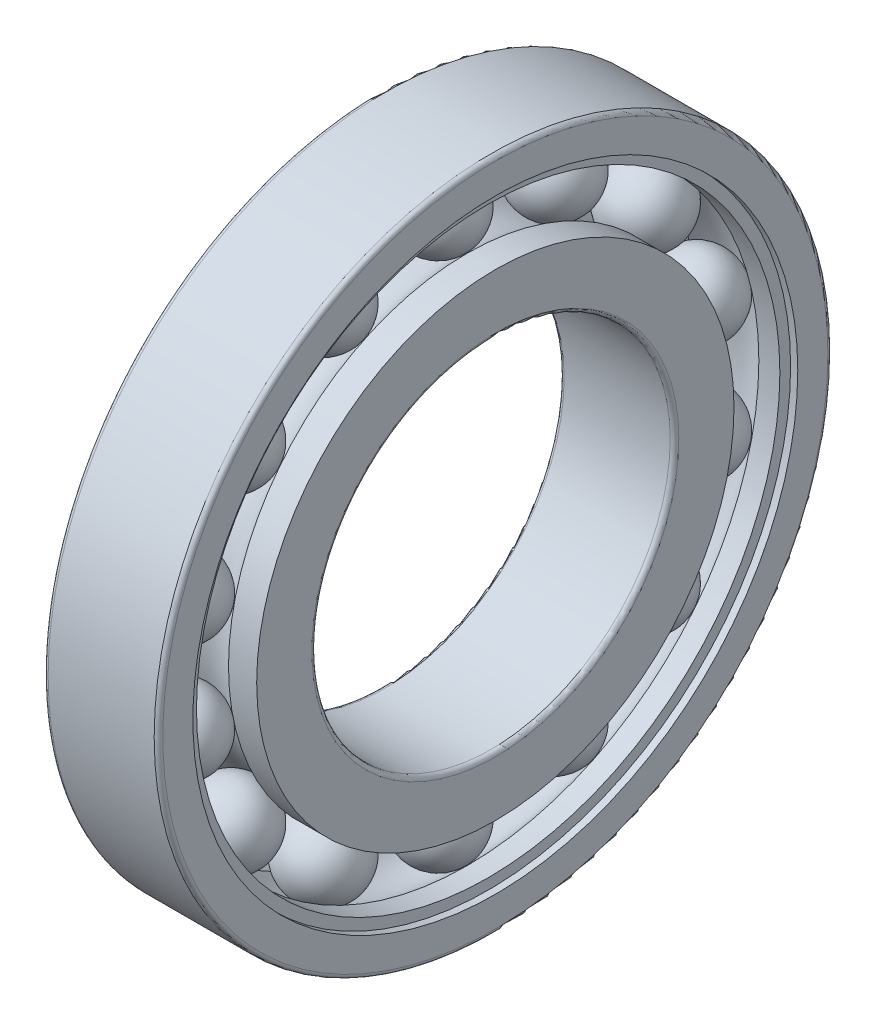
from build123d import *

# Parameters (mm, degrees)
SKETCH2_R          = 21.1
SKETCH2_R_2        = 20.35
CUT_EXTRUDE1_DEPTH = 0.5
FILLET1_R          = 0.3
FILLET2_R          = 0.3
CIRPATTERN4_COUNT  = 14


with BuildPart() as part:
    # Sketch1 → Revolve1 (revolve)
    with BuildSketch(Plane.XY, mode=Mode.PRIVATE) as revolve1_sk:
        with BuildLine():
            Line((4, 20.35), (4, 23.5))
            Line((4, 23.5), (-4, 23.5))
            Line((-4, 23.5), (-4, 20.35))
            Line((-4, 20.35), (-2.034698995, 20.35))
            ThreePointArc((-2.034698995, 20.35), (0, 21.25), (2.034698995, 20.35))
            Line((2.034698995, 20.35), (4, 20.35))
        make_face()
        with BuildLine():
            ThreePointArc((2.034698995, 16.65), (0, 15.75), (-2.034698995, 16.65))
            Line((-2.034698995, 16.65), (-4, 16.65))
            Line((-4, 16.65), (-4, 12.5))
            Line((-4, 12.5), (4, 12.5))
            Line((4, 12.5), (4, 16.65))
            Line((4, 16.65), (2.034698995, 16.65))
        make_face()
    revolve(revolve1_sk.sketch.rotate(Axis((0, 0, 0), (1, 0, 0)), 90), axis=Axis((0, 0, 0), (1, 0, 0)))

    # Sketch2 → Cut-Extrude1 (cut)
    with BuildSketch(Plane(origin=(4, 0, 0), x_dir=(0, 0, -1), z_dir=(1, 0, 0))):
        Circle(SKETCH2_R)
        with Locations(Location((0, 0, 0), (0, 0, 180))):
            Circle(SKETCH2_R_2, mode=Mode.SUBTRACT)
    cut_extrude1 = extrude(amount=-CUT_EXTRUDE1_DEPTH, mode=Mode.SUBTRACT)

    # Mirror1: Cut-Extrude1 across plane
    add(cut_extrude1.mirror(Plane(origin=(0, 0, 0), x_dir=(0, 0, 1), z_dir=(1, 0, 0))), mode=Mode.SUBTRACT)

    # Fillet1
    fillet1_edges = [part.edges().sort_by_distance(p)[0] for p in [
        (-4, 0, -23.5),
        (4, 0, -23.5),
    ]]
    fillet(fillet1_edges, radius=FILLET1_R)

    # Fillet2
    fillet2_edges = [part.edges().sort_by_distance(p)[0] for p in [
        (4, 0, -12.5),
        (-4, 0, -12.5),
    ]]
    fillet(fillet2_edges, radius=FILLET2_R)


with BuildPart() as body_2:
    # Sketch3 → Revolve2 (revolve)
    with BuildSketch(Plane.XY):
        with BuildLine():
            Line((-2.725, 18.5), (2.725, 18.5))
            ThreePointArc((2.725, 18.5), (0, 21.225), (-2.725, 18.5))
        make_face()
    revolve(axis=Axis((-2.725, 18.5, 0), (1, 0, 0)))


with BuildPart() as cirpattern4_1:
    # CirPattern4: pattern copy
    add(body_2.part.rotate(Axis((0, 0, 0), (1, 0, 0)), 1 * 360 / CIRPATTERN4_COUNT))


with BuildPart() as cirpattern4_2:
    # CirPattern4: pattern copy
    add(body_2.part.rotate(Axis((0, 0, 0), (1, 0, 0)), 2 * 360 / CIRPATTERN4_COUNT))


with BuildPart() as cirpattern4_3:
    # CirPattern4: pattern copy
    add(body_2.part.rotate(Axis((0, 0, 0), (1, 0, 0)), 3 * 360 / CIRPATTERN4_COUNT))


with BuildPart() as cirpattern4_4:
    # CirPattern4: pattern copy
    add(body_2.part.rotate(Axis((0, 0, 0), (1, 0, 0)), 4 * 360 / CIRPATTERN4_COUNT))


with BuildPart() as cirpattern4_5:
    # CirPattern4: pattern copy
    add(body_2.part.rotate(Axis((0, 0, 0), (1, 0, 0)), 5 * 360 / CIRPATTERN4_COUNT))


with BuildPart() as cirpattern4_6:
    # CirPattern4: pattern copy
    add(body_2.part.rotate(Axis((0, 0, 0), (1, 0, 0)), 6 * 360 / CIRPATTERN4_COUNT))


with BuildPart() as cirpattern4_7:
    # CirPattern4: pattern copy
    add(body_2.part.rotate(Axis((0, 0, 0), (1, 0, 0)), 7 * 360 / CIRPATTERN4_COUNT))


with BuildPart() as cirpattern4_8:
    # CirPattern4: pattern copy
    add(body_2.part.rotate(Axis((0, 0, 0), (1, 0, 0)), 8 * 360 / CIRPATTERN4_COUNT))


with BuildPart() as cirpattern4_9:
    # CirPattern4: pattern copy
    add(body_2.part.rotate(Axis((0, 0, 0), (1, 0, 0)), 9 * 360 / CIRPATTERN4_COUNT))


with BuildPart() as cirpattern4_10:
    # CirPattern4: pattern copy
    add(body_2.part.rotate(Axis((0, 0, 0), (1, 0, 0)), 10 * 360 / CIRPATTERN4_COUNT))


with BuildPart() as cirpattern4_11:
    # CirPattern4: pattern copy
    add(body_2.part.rotate(Axis((0, 0, 0), (1, 0, 0)), 11 * 360 / CIRPATTERN4_COUNT))


with BuildPart() as cirpattern4_12:
    # CirPattern4: pattern copy
    add(body_2.part.rotate(Axis((0, 0, 0), (1, 0, 0)), 12 * 360 / CIRPATTERN4_COUNT))


with BuildPart() as cirpattern4_13:
    # CirPattern4: pattern copy
    add(body_2.part.rotate(Axis((0, 0, 0), (1, 0, 0)), 13 * 360 / CIRPATTERN4_COUNT))


solid = Compound([part.part, body_2.part, cirpattern4_1.part, cirpattern4_2.part, cirpattern4_3.part, cirpattern4_4.part, cirpattern4_5.part, cirpattern4_6.part, cirpattern4_7.part, cirpattern4_8.part, cirpattern4_9.part, cirpattern4_10.part, cirpattern4_11.part, cirpattern4_12.part, cirpattern4_13.part])
